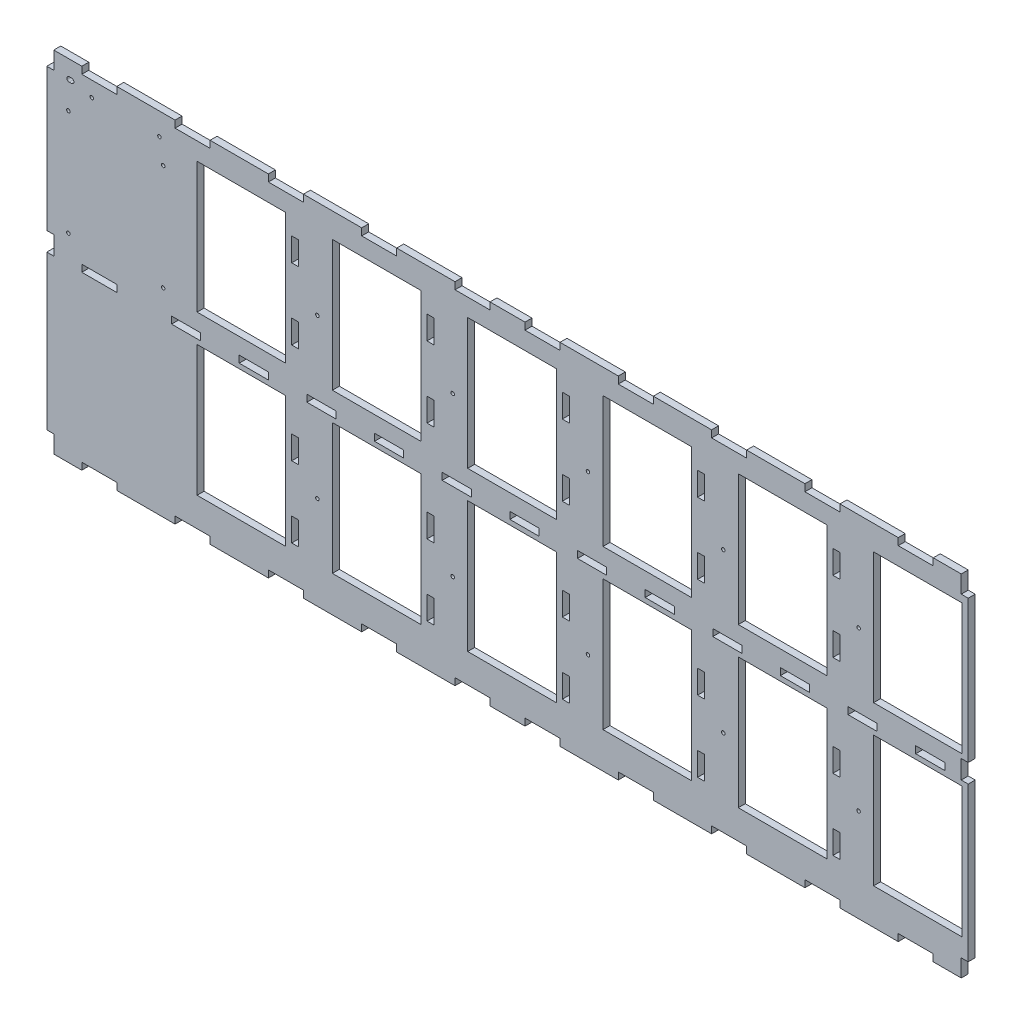
from build123d import *

# Parameters (mm, degrees)
SKETCH1_W           = 790
SKETCH1_H           = 300
SKETCH1_W_2         = 76
SKETCH1_H_2         = 112
BOSS_EXTRUDE1_DEPTH = 6
SKETCH2_R           = 1.5
CUT_EXTRUDE1_DEPTH  = 10
SKETCH3_W           = 6
SKETCH3_H           = 15
SKETCH3_H_2         = 16
SKETCH3_W_2         = 30
SKETCH3_H_3         = 6
CUT_EXTRUDE2_DEPTH  = 6
SKETCH4_W           = 25
SKETCH4_H           = 6
SKETCH4_W_2         = 6
SKETCH4_H_2         = 20
SKETCH4_W_3         = 30
CUT_EXTRUDE3_DEPTH  = 6
CUT_EXTRUDE4_DEPTH  = 6


with BuildPart() as part:
    # Sketch1 → Boss-Extrude1 (new body)
    with BuildSketch(Plane.XY):
        Rectangle(SKETCH1_W, SKETCH1_H)
        with Locations((-228.15, 72.85)):
            Rectangle(SKETCH1_W_2, SKETCH1_H_2, mode=Mode.SUBTRACT)
        with Locations((-112.15, 72.85)):
            Rectangle(SKETCH1_W_2, SKETCH1_H_2, mode=Mode.SUBTRACT)
        with Locations((3.85, 72.85)):
            Rectangle(SKETCH1_W_2, SKETCH1_H_2, mode=Mode.SUBTRACT)
        with Locations((119.85, 72.85)):
            Rectangle(SKETCH1_W_2, SKETCH1_H_2, mode=Mode.SUBTRACT)
        with Locations((235.85, 72.85)):
            Rectangle(SKETCH1_W_2, SKETCH1_H_2, mode=Mode.SUBTRACT)
        with Locations((-112.15, -63.15)):
            Rectangle(SKETCH1_W_2, SKETCH1_H_2, mode=Mode.SUBTRACT)
        with Locations((3.85, -63.15)):
            Rectangle(SKETCH1_W_2, SKETCH1_H_2, mode=Mode.SUBTRACT)
        with Locations((119.85, -63.15)):
            Rectangle(SKETCH1_W_2, SKETCH1_H_2, mode=Mode.SUBTRACT)
        with Locations((235.85, -63.15)):
            Rectangle(SKETCH1_W_2, SKETCH1_H_2, mode=Mode.SUBTRACT)
        with Locations((-228.15, -63.15)):
            Rectangle(SKETCH1_W_2, SKETCH1_H_2, mode=Mode.SUBTRACT)
        with Locations((351.85, 72.85)):
            Rectangle(SKETCH1_W_2, SKETCH1_H_2, mode=Mode.SUBTRACT)
        with Locations((351.85, -63.15)):
            Rectangle(SKETCH1_W_2, SKETCH1_H_2, mode=Mode.SUBTRACT)
    extrude(amount=BOSS_EXTRUDE1_DEPTH)

    # Sketch2 → Cut-Extrude1 (cut)
    with BuildSketch(Plane.XY.offset(6)):
        with Locations((301, -70)):
            Circle(SKETCH2_R)
        with Locations((301, 66)):
            Circle(SKETCH2_R)
        with Locations((185, -70)):
            Circle(SKETCH2_R)
        with Locations((185, 66)):
            Circle(SKETCH2_R)
        with Locations((69, -70)):
            Circle(SKETCH2_R)
        with Locations((69, 66)):
            Circle(SKETCH2_R)
        with Locations((-47, -70)):
            Circle(SKETCH2_R)
        with Locations((-47, 66)):
            Circle(SKETCH2_R)
        with Locations((-163, -70)):
            Circle(SKETCH2_R)
        with Locations((-163, 66)):
            Circle(SKETCH2_R)
        with Locations((-295.18, 20.318823529)):
            Circle(SKETCH2_R)
        with Locations((-376.46, 20.318823529)):
            Circle(SKETCH2_R)
        with Locations((-376.46, 111.161176471)):
            Circle(SKETCH2_R)
        with Locations((-295.18, 111.161176471)):
            Circle(SKETCH2_R)
        with Locations((-298.414655667, 130.998270161)):
            Circle(SKETCH2_R)
        with Locations((-356.414655667, 130.998270161)):
            Circle(SKETCH2_R)
    extrude(amount=-CUT_EXTRUDE1_DEPTH, mode=Mode.SUBTRACT)

    # Sketch3 → Cut-Extrude2 (cut)
    with BuildSketch(Plane.XY.offset(6)):
        with Locations((392, 142.5)):
            Rectangle(SKETCH3_W, SKETCH3_H)
        with Locations((392, 5)):
            Rectangle(SKETCH3_W, SKETCH3_H_2)
        with Locations((392, -142.5)):
            Rectangle(SKETCH3_W, SKETCH3_H)
        with Locations((-392, -142.5)):
            Rectangle(SKETCH3_W, SKETCH3_H)
        with Locations((-392, 5)):
            Rectangle(SKETCH3_W, SKETCH3_H_2)
        with Locations((-392, 142.5)):
            Rectangle(SKETCH3_W, SKETCH3_H)
        with Locations((30, 147)):
            Rectangle(SKETCH3_W_2, SKETCH3_H_3)
        with Locations((110, 147)):
            Rectangle(SKETCH3_W_2, SKETCH3_H_3)
        with Locations((190, 147)):
            Rectangle(SKETCH3_W_2, SKETCH3_H_3)
        with Locations((270, 147)):
            Rectangle(SKETCH3_W_2, SKETCH3_H_3)
        with Locations((350, 147)):
            Rectangle(SKETCH3_W_2, SKETCH3_H_3)
        with Locations((-350, 147)):
            Rectangle(SKETCH3_W_2, SKETCH3_H_3)
        with Locations((-270, 147)):
            Rectangle(SKETCH3_W_2, SKETCH3_H_3)
        with Locations((-190, 147)):
            Rectangle(SKETCH3_W_2, SKETCH3_H_3)
        with Locations((-110, 147)):
            Rectangle(SKETCH3_W_2, SKETCH3_H_3)
        with Locations((-30, 147)):
            Rectangle(SKETCH3_W_2, SKETCH3_H_3)
        with Locations((-30, -147)):
            Rectangle(SKETCH3_W_2, SKETCH3_H_3)
        with Locations((-110, -147)):
            Rectangle(SKETCH3_W_2, SKETCH3_H_3)
        with Locations((-190, -147)):
            Rectangle(SKETCH3_W_2, SKETCH3_H_3)
        with Locations((-270, -147)):
            Rectangle(SKETCH3_W_2, SKETCH3_H_3)
        with Locations((-350, -147)):
            Rectangle(SKETCH3_W_2, SKETCH3_H_3)
        with Locations((350, -147)):
            Rectangle(SKETCH3_W_2, SKETCH3_H_3)
        with Locations((270, -147)):
            Rectangle(SKETCH3_W_2, SKETCH3_H_3)
        with Locations((190, -147)):
            Rectangle(SKETCH3_W_2, SKETCH3_H_3)
        with Locations((110, -147)):
            Rectangle(SKETCH3_W_2, SKETCH3_H_3)
        with Locations((30, -147)):
            Rectangle(SKETCH3_W_2, SKETCH3_H_3)
    extrude(amount=-CUT_EXTRUDE2_DEPTH, mode=Mode.SUBTRACT)

    # Sketch4 → Cut-Extrude3 (cut)
    with BuildSketch(Plane.XY.offset(6)):
        with Locations((304.5, 0)):
            Rectangle(SKETCH4_W, SKETCH4_H)
        with Locations((282, -104)):
            Rectangle(SKETCH4_W_2, SKETCH4_H_2)
        with Locations((282, -43)):
            Rectangle(SKETCH4_W_2, SKETCH4_H_2)
        with Locations((282, 43)):
            Rectangle(SKETCH4_W_2, SKETCH4_H_2)
        with Locations((282, 104)):
            Rectangle(SKETCH4_W_2, SKETCH4_H_2)
        with Locations((362.5, 0)):
            Rectangle(SKETCH4_W, SKETCH4_H)
        with Locations((246.5, 0)):
            Rectangle(SKETCH4_W, SKETCH4_H)
        with Locations((188.5, 0)):
            Rectangle(SKETCH4_W, SKETCH4_H)
        with Locations((130.5, 0)):
            Rectangle(SKETCH4_W, SKETCH4_H)
        with Locations((72.5, 0)):
            Rectangle(SKETCH4_W, SKETCH4_H)
        with Locations((14.5, 0)):
            Rectangle(SKETCH4_W, SKETCH4_H)
        with Locations((-43.5, 0)):
            Rectangle(SKETCH4_W, SKETCH4_H)
        with Locations((-101.5, 0)):
            Rectangle(SKETCH4_W, SKETCH4_H)
        with Locations((-159.5, 0)):
            Rectangle(SKETCH4_W, SKETCH4_H)
        with Locations((-217.5, 0)):
            Rectangle(SKETCH4_W, SKETCH4_H)
        with Locations((-275.5, 0)):
            Rectangle(SKETCH4_W, SKETCH4_H)
        with Locations((166, -104)):
            Rectangle(SKETCH4_W_2, SKETCH4_H_2)
        with Locations((166, -43)):
            Rectangle(SKETCH4_W_2, SKETCH4_H_2)
        with Locations((166, 43)):
            Rectangle(SKETCH4_W_2, SKETCH4_H_2)
        with Locations((166, 104)):
            Rectangle(SKETCH4_W_2, SKETCH4_H_2)
        with Locations((50, -104)):
            Rectangle(SKETCH4_W_2, SKETCH4_H_2)
        with Locations((50, -43)):
            Rectangle(SKETCH4_W_2, SKETCH4_H_2)
        with Locations((50, 43)):
            Rectangle(SKETCH4_W_2, SKETCH4_H_2)
        with Locations((50, 104)):
            Rectangle(SKETCH4_W_2, SKETCH4_H_2)
        with Locations((-66, -104)):
            Rectangle(SKETCH4_W_2, SKETCH4_H_2)
        with Locations((-66, -43)):
            Rectangle(SKETCH4_W_2, SKETCH4_H_2)
        with Locations((-66, 43)):
            Rectangle(SKETCH4_W_2, SKETCH4_H_2)
        with Locations((-66, 104)):
            Rectangle(SKETCH4_W_2, SKETCH4_H_2)
        with Locations((-182, -104)):
            Rectangle(SKETCH4_W_2, SKETCH4_H_2)
        with Locations((-182, -43)):
            Rectangle(SKETCH4_W_2, SKETCH4_H_2)
        with Locations((-182, 43)):
            Rectangle(SKETCH4_W_2, SKETCH4_H_2)
        with Locations((-182, 104)):
            Rectangle(SKETCH4_W_2, SKETCH4_H_2)
        with Locations((-350, 0)):
            Rectangle(SKETCH4_W_3, SKETCH4_H)
    extrude(amount=-CUT_EXTRUDE3_DEPTH, mode=Mode.SUBTRACT)

    # Sketch5 → Cut-Extrude4 (cut)
    with BuildSketch(Plane.XY.offset(6)):
        with BuildLine():
            Line((-373.78550842, 132.81848594), (-375.78550842, 132.81848594))
            ThreePointArc((-375.78550842, 132.81848594), (-377.78550842, 134.81848594), (-375.78550842, 136.81848594))
            Line((-375.78550842, 136.81848594), (-373.78550842, 136.81848594))
            ThreePointArc((-373.78550842, 136.81848594), (-371.78550842, 134.81848594), (-373.78550842, 132.81848594))
        make_face()
    extrude(amount=-CUT_EXTRUDE4_DEPTH, mode=Mode.SUBTRACT)


solid = part.part
